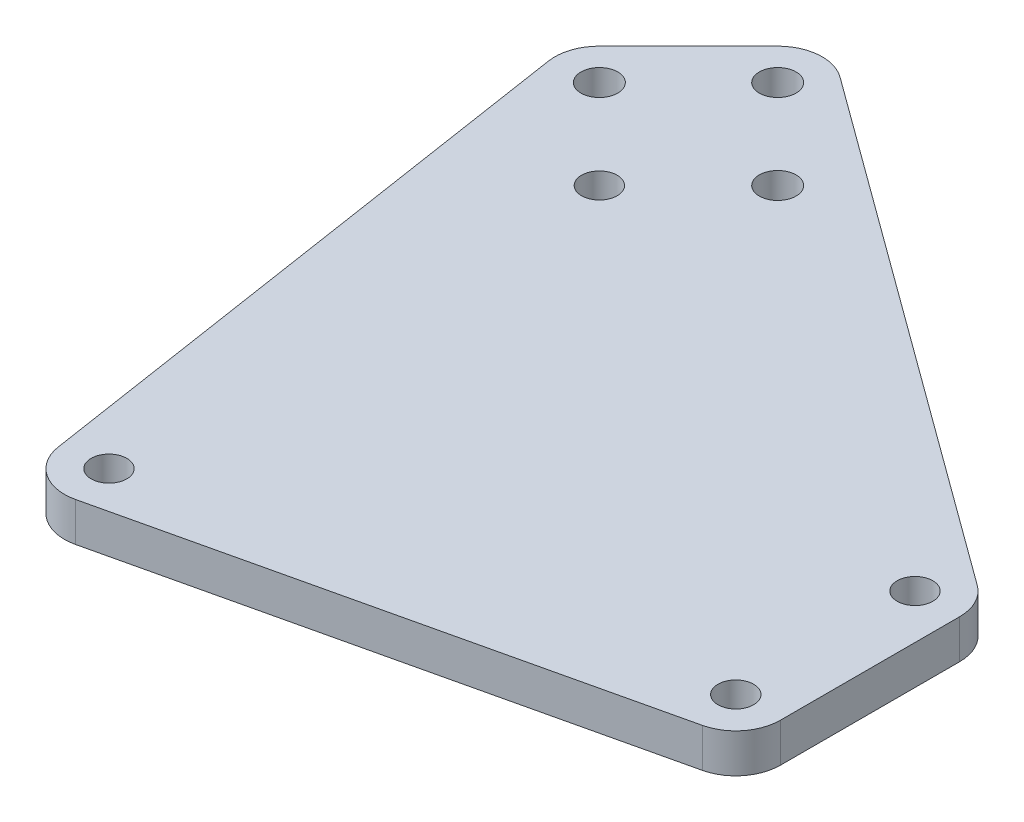
from build123d import *

# Parameters (mm, degrees)
SKETCH_1_R      = 1.6
SKETCH_1_R_2    = 1.65
EXTRUDE_1_DEPTH = 3.5


with BuildPart() as part:
    # 草图1 → 凸台-拉伸1 (new body)
    with BuildSketch(Plane(origin=(0, 0, 0), x_dir=(1, 0, 0), z_dir=(0, 1, 0))):
        with BuildLine():
            Line((8304.199636281, 3083.866766782), (8349.87122342, 3094.435360284))
            ThreePointArc((8349.87122342, 3094.435360284), (8352.100502408, 3095.843120102), (8352.969436472, 3098.332382262))
            Line((8352.969436472, 3098.332382262), (8352.969436472, 3114.411583007))
            ThreePointArc((8352.969436472, 3114.411583007), (8352.5356662, 3116.223213635), (8351.328433707, 3117.641928507))
            Line((8351.328433707, 3117.641928507), (8305.656846567, 3150.99413426))
            ThreePointArc((8305.656846567, 3150.99413426), (8302.988857908, 3151.75183644), (8300.469422208, 3150.592215885))
            Line((8300.469422208, 3150.592215885), (8292.469422208, 3142.592215885))
            ThreePointArc((8292.469422208, 3142.592215885), (8291.496370678, 3141.008280638), (8291.344362542, 3139.155560023))
            Line((8291.344362542, 3139.155560023), (8299.344362542, 3087.155560023))
            ThreePointArc((8299.344362542, 3087.155560023), (8301.054579793, 3084.452030652), (8304.199636281, 3083.866766782))
        make_face()
        with Locations(Location((8348.969436472, 3098.332382262, 0), (0, 0, 270))):
            Circle(SKETCH_1_R, mode=Mode.SUBTRACT)
        with Locations(Location((8348.969436472, 3114.411583007, 0), (0, 0, 270))):
            Circle(SKETCH_1_R, mode=Mode.SUBTRACT)
        with Locations(Location((8303.297849333, 3131.76378876, 0), (0, 0, 270))):
            Circle(SKETCH_1_R, mode=Mode.SUBTRACT)
        with Locations(Location((8303.297849333, 3087.76378876, 0), (0, 0, 270))):
            Circle(SKETCH_1_R, mode=Mode.SUBTRACT)
        with Locations(Location((8303.297849333, 3147.76378876, 0), (0, 0, 270))):
            Circle(SKETCH_1_R_2, mode=Mode.SUBTRACT)
        with Locations(Location((8295.297849333, 3139.76378876, 0), (0, 0, 270))):
            Circle(SKETCH_1_R_2, mode=Mode.SUBTRACT)
        with Locations(Location((8311.297849333, 3139.76378876, 0), (0, 0, 270))):
            Circle(SKETCH_1_R_2, mode=Mode.SUBTRACT)
    extrude(amount=EXTRUDE_1_DEPTH)


solid = part.part
